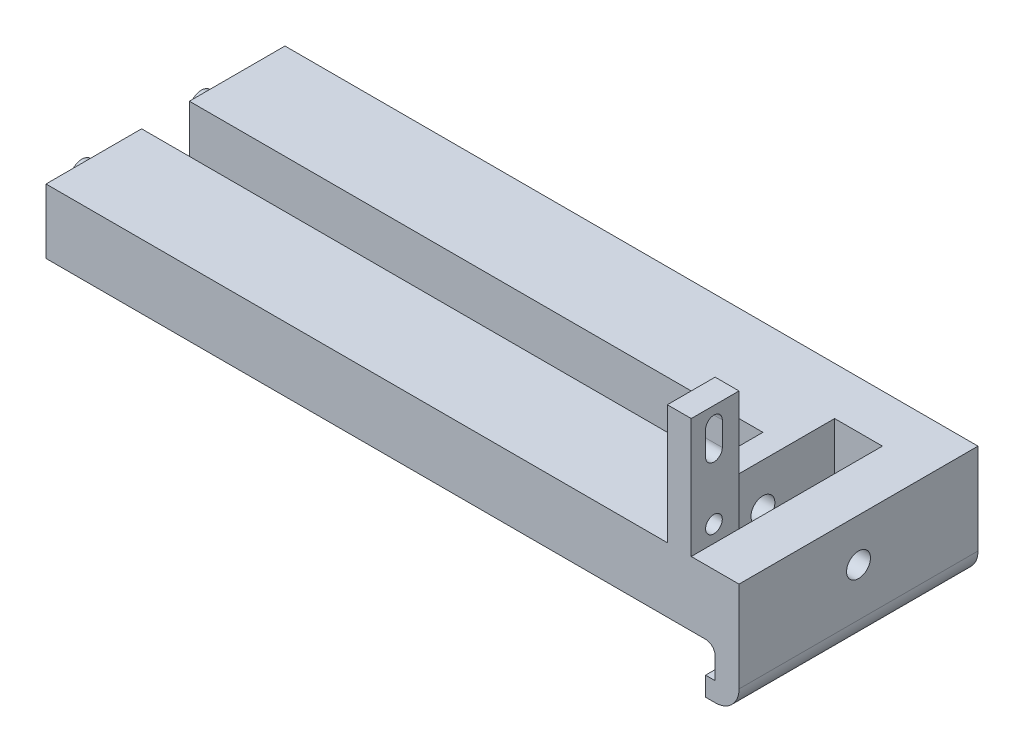
from build123d import *

# Parameters (mm, degrees)
SKETCH1_W               = 140
SKETCH1_H               = 13.5
BOSS_EXTRUDE1_DEPTH     = 50
SKETCH2_R               = 2.5
BOSS_EXTRUDE2_DEPTH     = 5
SKETCH6_W               = 50
SKETCH6_H               = 24
BOSS_EXTRUDE4_DEPTH     = 5
CUT_EXTRUDE1_DEPTH      = 156.244967712
CUT_EXTRUDE1_DEPTH_BACK = 156.244967712
SKETCH4_W               = 10
SKETCH4_H               = 30
SKETCH7_R               = 2.5
CUT_EXTRUDE3_DEPTH      = 35
SKETCH8_W               = 50
SKETCH8_H               = 4
BOSS_EXTRUDE5_DEPTH     = 2
SKETCH9_W               = 120
SKETCH9_H               = 10
CUT_EXTRUDE4_DEPTH      = 15
SKETCH10_W              = 5
SKETCH10_H              = 10
BOSS_EXTRUDE6_DEPTH     = 25
CUT_EXTRUDE5_DEPTH      = 150.020971678
CUT_EXTRUDE5_DEPTH_BACK = 150.020971678
SKETCH13_R              = 1.75
FILLET1_R               = 2
FILLET2_R               = 5


with BuildPart() as part:
    # Sketch1 → Boss-Extrude1 (new body)
    with BuildSketch(Plane.XY):
        with Locations((-70, 6.75)):
            Rectangle(SKETCH1_W, SKETCH1_H)
    extrude(amount=BOSS_EXTRUDE1_DEPTH)

    # Sketch2 → Boss-Extrude2 (add)
    with BuildSketch(Plane.ZY.offset(140)):
        with Locations(Location((12.5, 6.75, 0), (0, 0, 180))):
            Circle(SKETCH2_R)
        with Locations(Location((37.5, 6.75, 0), (0, 0, 180))):
            Circle(SKETCH2_R)
    extrude(amount=BOSS_EXTRUDE2_DEPTH)

    # Sketch6 → Boss-Extrude4 (add)
    with BuildSketch(Plane(origin=(0, 0, 0), x_dir=(0, 0, -1), z_dir=(1, 0, 0))):
        with Locations((-25, 1.5)):
            Rectangle(SKETCH6_W, SKETCH6_H)
    extrude(amount=BOSS_EXTRUDE4_DEPTH)

    # Sketch4 → Cut-Extrude1 (cut, two sides: drawn at the far end of the back side and taken through both)
    with BuildSketch(Plane(origin=(0, 13.5, 0), x_dir=(1, 0, 0), z_dir=(0, 1, 0)).offset(-CUT_EXTRUDE1_DEPTH_BACK)):
        with Locations((-10, -25)):
            Rectangle(SKETCH4_W, SKETCH4_H)
    extrude(amount=CUT_EXTRUDE1_DEPTH + CUT_EXTRUDE1_DEPTH_BACK, mode=Mode.SUBTRACT)

    # Sketch7 → Cut-Extrude3 (cut)
    with BuildSketch(Plane(origin=(5, 0, 0), x_dir=(0, 0, -1), z_dir=(1, 0, 0))):
        with Locations(Location((-25, 4.5, 0), (0, 0, 90))):
            Circle(SKETCH7_R)
    extrude(amount=-CUT_EXTRUDE3_DEPTH, mode=Mode.SUBTRACT)

    # Sketch8 → Boss-Extrude5 (add)
    with BuildSketch(Plane.ZY):
        with Locations((25, -8.5)):
            Rectangle(SKETCH8_W, SKETCH8_H)
    extrude(amount=BOSS_EXTRUDE5_DEPTH)

    # Sketch9 → Cut-Extrude4 (cut)
    with BuildSketch(Plane(origin=(0, 13.5, 0), x_dir=(1, 0, 0), z_dir=(0, 1, 0))):
        with Locations((-80, -25)):
            Rectangle(SKETCH9_W, SKETCH9_H)
    extrude(amount=-CUT_EXTRUDE4_DEPTH, mode=Mode.SUBTRACT)

    # Sketch10 → Boss-Extrude6 (add)
    with BuildSketch(Plane(origin=(0, 13.5, 0), x_dir=(1, 0, 0), z_dir=(0, 1, 0))):
        with Locations((-7.5, -45)):
            Rectangle(SKETCH10_W, SKETCH10_H)
    extrude(amount=BOSS_EXTRUDE6_DEPTH)

    # Sketch13 → Cut-Extrude5 (cut, two sides: drawn at the far end of the back side and taken through both)
    with BuildSketch(Plane.ZY.offset(10).offset(-CUT_EXTRUDE5_DEPTH_BACK)):
        with Locations((45.25, 17)):
            Circle(SKETCH13_R)
        with BuildLine():
            Line((43.5, 30), (43.5, 35))
            ThreePointArc((43.5, 35), (45.25, 36.75), (47, 35))
            Line((47, 35), (47, 30))
            ThreePointArc((47, 30), (45.25, 28.25), (43.5, 30))
        make_face()
    extrude(amount=CUT_EXTRUDE5_DEPTH + CUT_EXTRUDE5_DEPTH_BACK, mode=Mode.SUBTRACT)

    # Fillet1
    fillet1_edges = [part.edges().sort_by_distance(p)[0] for p in [
        (0, 0, 25),
    ]]
    fillet(fillet1_edges, radius=FILLET1_R)

    # Fillet2
    fillet2_edges = [part.edges().sort_by_distance(p)[0] for p in [
        (5, -10.5, 25),
    ]]
    fillet(fillet2_edges, radius=FILLET2_R)


solid = part.part
